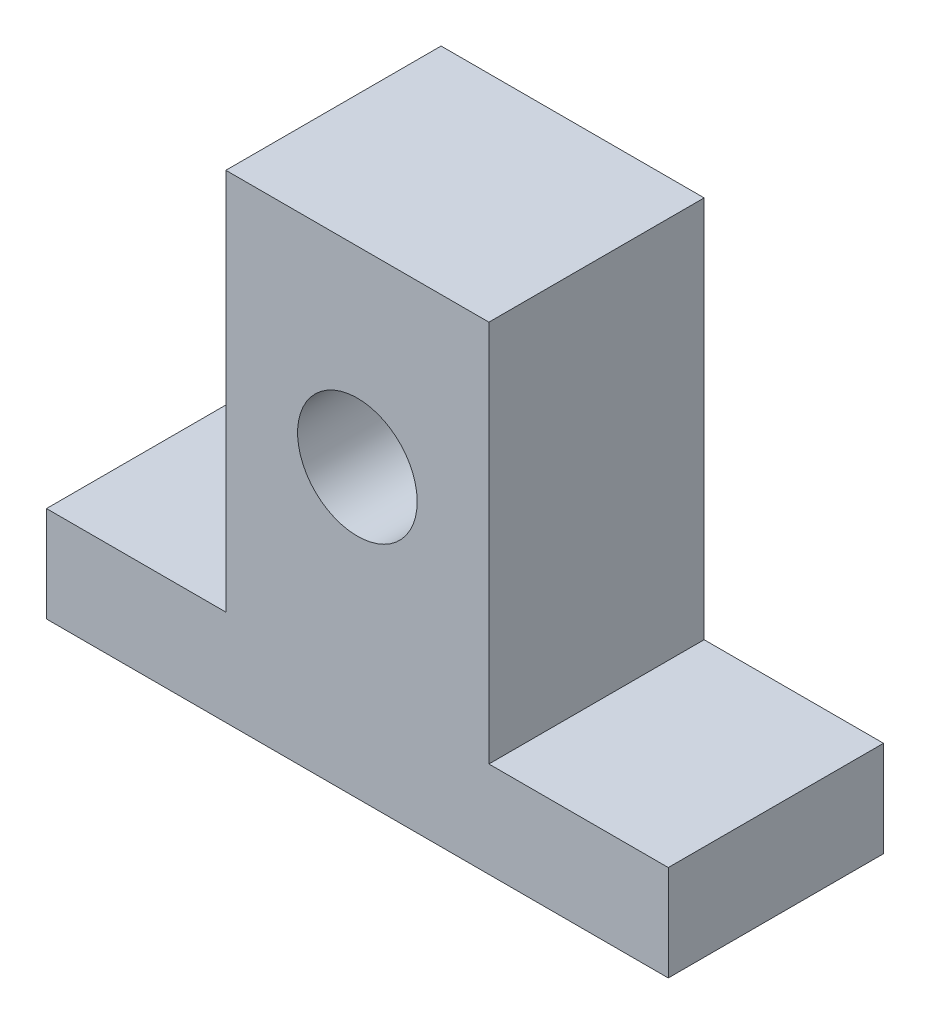
from build123d import *

# Parameters (mm, degrees)
SKETCH1_W           = 41.275
SKETCH1_H           = 6.35
SKETCH1_W_2         = 17.4625
SKETCH1_H_2         = 25.4
SKETCH1_R           = 3.96875
BOSS_EXTRUDE1_DEPTH = 14.2875


with BuildPart() as part:
    # Sketch1 → Boss-Extrude1 (new body)
    # profile 1 of 2: a face of its own
    with BuildSketch(Plane.XY):
        Rectangle(SKETCH1_W, SKETCH1_H)
    # profile 2 of 2: a face of its own
    with BuildSketch(Plane.XY):
        with Locations((0, 15.875)):
            Rectangle(SKETCH1_W_2, SKETCH1_H_2)
        with Locations((0, 15.875)):
            Circle(SKETCH1_R, mode=Mode.SUBTRACT)
    extrude(amount=BOSS_EXTRUDE1_DEPTH)


solid = part.part
